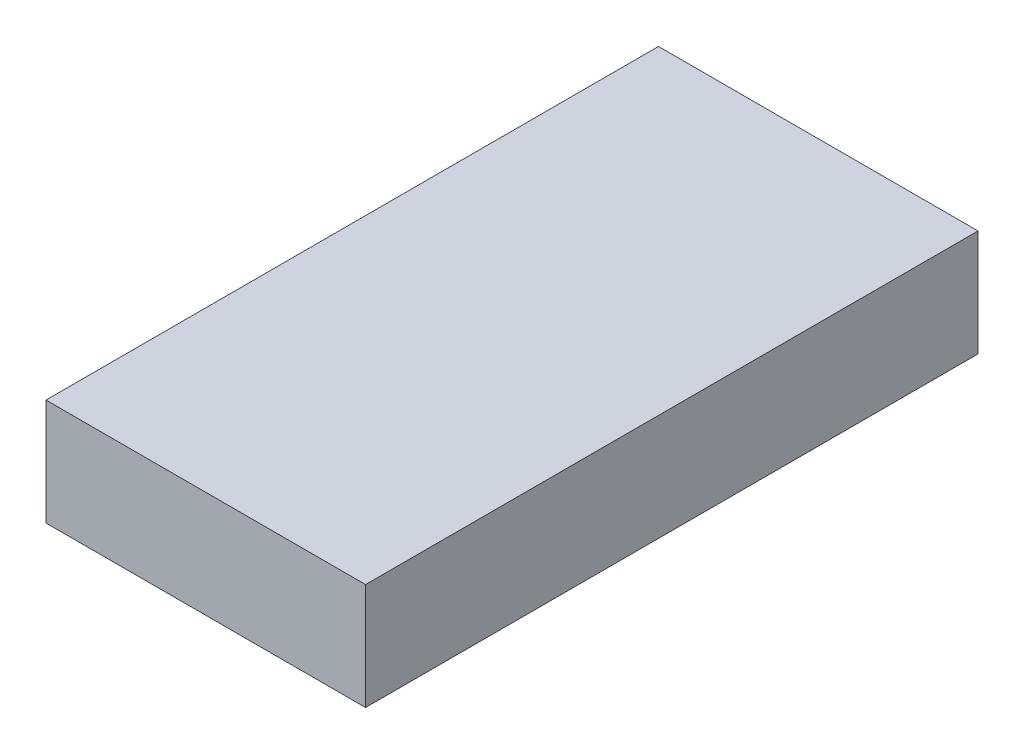
from build123d import *

# Parameters (mm, degrees)
SKETCH1_W           = 60
SKETCH1_H           = 115
BOSS_EXTRUDE1_DEPTH = 20


with BuildPart() as part:
    # Sketch1 → Boss-Extrude1 (new body)
    with BuildSketch(Plane(origin=(0, 0, 0), x_dir=(1, 0, 0), z_dir=(0, 1, 0))):
        with Locations((30, 57.5)):
            Rectangle(SKETCH1_W, SKETCH1_H)
    extrude(amount=BOSS_EXTRUDE1_DEPTH)


solid = part.part
